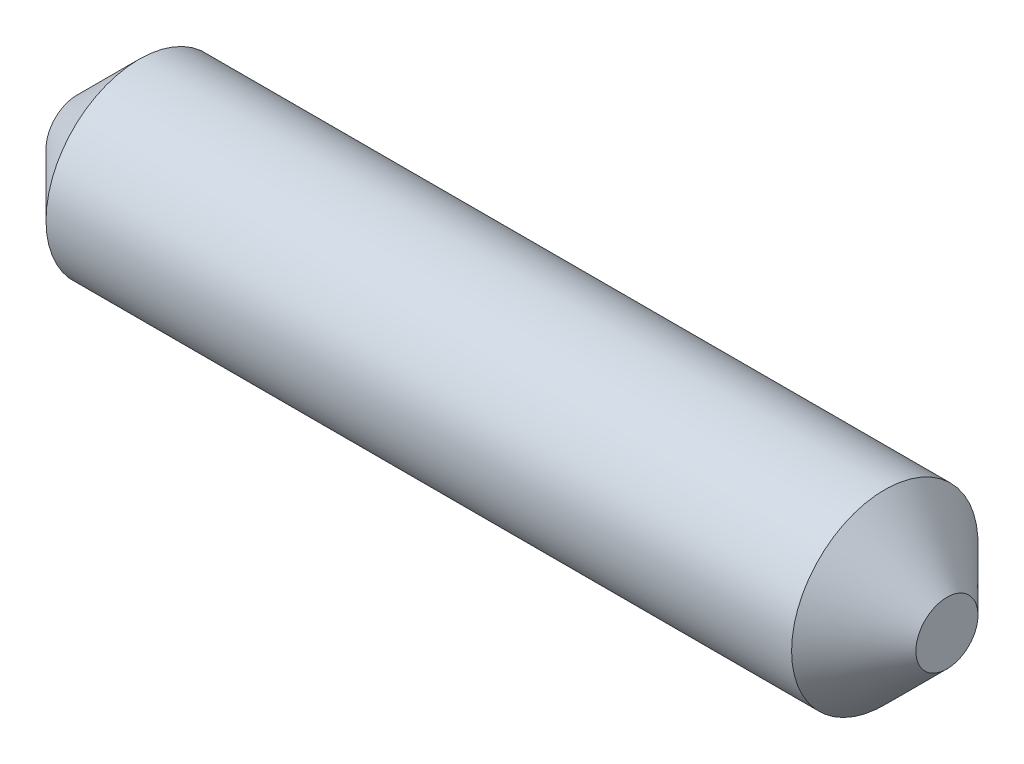
from build123d import *

# Parameters (mm, degrees)
SZKIC1_R                    = 1.5
DODANIE_WYCI_GNI_CIE1_DEPTH = 7
SFAZOWANIE1_SIZE            = 1


with BuildPart() as part:
    # Szkic1 → Dodanie-wyciągnięcie1 (new, symmetric)
    with BuildSketch(Plane(origin=(0, 0, 0), x_dir=(0, 0, -1), z_dir=(1, 0, 0))):
        Circle(SZKIC1_R)
    extrude(amount=DODANIE_WYCI_GNI_CIE1_DEPTH, both=True)

    # Sfazowanie1
    sfazowanie1_edges = [part.edges().sort_by_distance(p)[0] for p in [
        (-7, 0, 1.5),
        (7, 0, 1.5),
    ]]
    chamfer(sfazowanie1_edges, length=SFAZOWANIE1_SIZE)


solid = part.part
